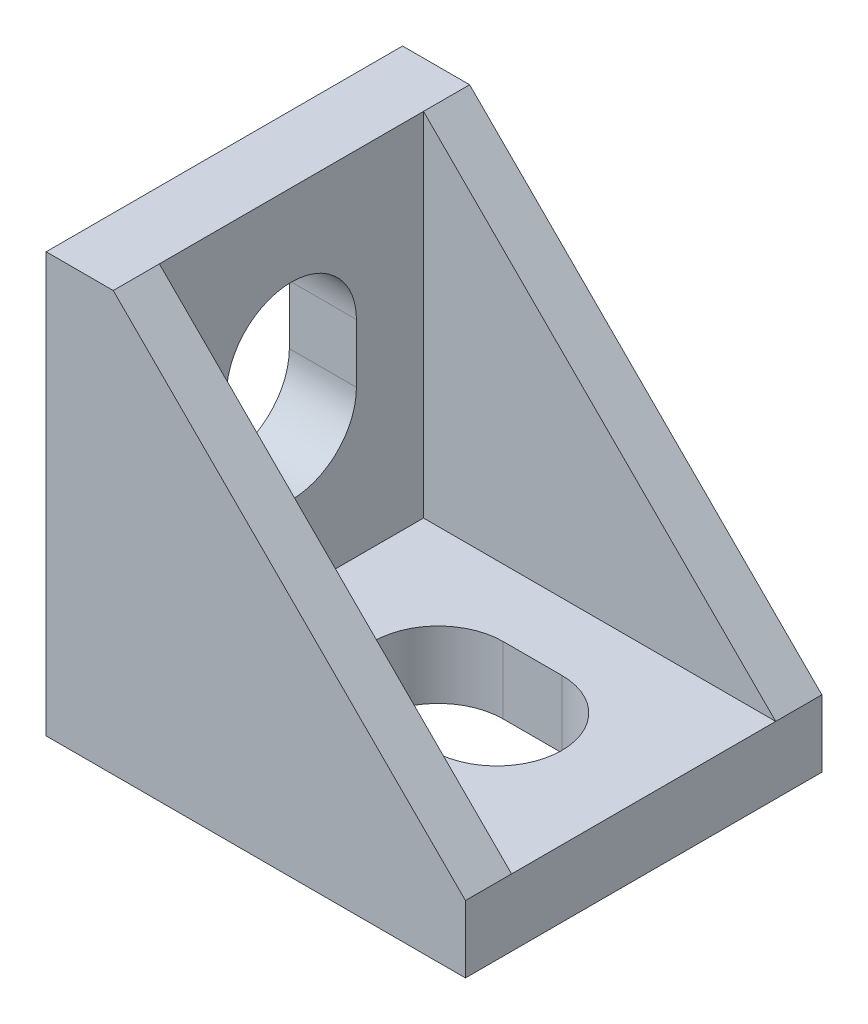
from build123d import *

# Parameters (mm, degrees)
SKETCH_1_W               = 20
SKETCH_1_H               = 20
EXTRUDE_1_DEPTH          = 17
SKETCH_2_W               = 16.8
SKETCH_2_H               = 12.6
CUT_EXTRUDE_1_DEPTH      = 16.8
CUT_EXTRUDE_2_DEPTH      = 16.8
CUT_EXTRUDE_2_DEPTH_BACK = 16.8
CUT_EXTRUDE_3_DEPTH      = 16.8


with BuildPart() as part:
    # 草图1 → 凸台-拉伸1 (new body)
    with BuildSketch(Plane.XY):
        Rectangle(SKETCH_1_W, SKETCH_1_H)
    extrude(amount=EXTRUDE_1_DEPTH)

    # 草图2 → 切除-拉伸1 (cut)
    with BuildSketch(Plane(origin=(0, 10, 0), x_dir=(1, 0, 0), z_dir=(0, 1, 0))):
        with Locations((1.6, -8.5)):
            Rectangle(SKETCH_2_W, SKETCH_2_H)
    extrude(amount=-CUT_EXTRUDE_1_DEPTH, mode=Mode.SUBTRACT)

    # 草图3 → 切除-拉伸2 (cut, two sides: drawn at the far end of the back side and taken through both)
    with BuildSketch(Plane.XY.offset(2.2).offset(-CUT_EXTRUDE_2_DEPTH_BACK)):
        Polygon((-6.8, 10), (10, -6.8), (10, 10), align=None)
    extrude(amount=CUT_EXTRUDE_2_DEPTH + CUT_EXTRUDE_2_DEPTH_BACK, mode=Mode.SUBTRACT)

    # 草图4 → 切除-拉伸3 (cut)
    with BuildSketch(Plane(origin=(-6.8, 0, 0), x_dir=(0, 0, -1), z_dir=(1, 0, 0))):
        with BuildLine():
            Line((-5.4, 0.2), (-5.4, 3))
            ThreePointArc((-5.4, 3), (-8.5, 6.1), (-11.6, 3))
            Line((-11.6, 3), (-11.6, 0.2))
            ThreePointArc((-11.6, 0.2), (-8.5, -2.9), (-5.4, 0.2))
        make_face()
    cut_extrude_3 = extrude(amount=-CUT_EXTRUDE_3_DEPTH, mode=Mode.SUBTRACT)

    # 镜向1: 切除-拉伸3 across plane
    add(cut_extrude_3.mirror(Plane(origin=(0, 0, 0), x_dir=(0, 0, 1), z_dir=(0.7071067811865479, -0.7071067811865471, 0))), mode=Mode.SUBTRACT)


solid = part.part
